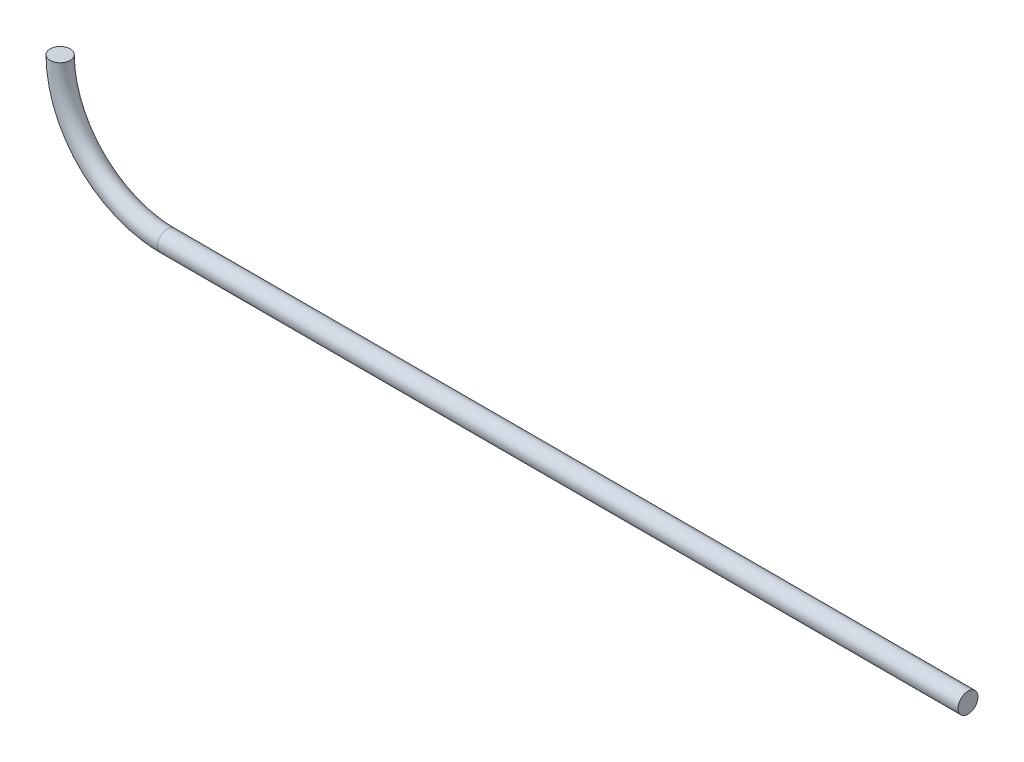
from build123d import *

# Parameters (mm, degrees)
SKETCH6_R = 0.5


with BuildPart() as part:
    # Sweep1: sweep along a path in Sketch1
    with BuildLine(Plane.XY) as sweep1_path:
        Line((40, -5.36), (0, -5.36))
        ThreePointArc((0, -5.36), (-3.790092347, -3.790092347), (-5.36, 0))
    # Sketch6 → Sweep1 (sweep)
    with BuildSketch(Plane(origin=(0, 0, 0), x_dir=(1, 0, 0), z_dir=(0, 1, 0))):
        with Locations((-5.36, 0)):
            Circle(SKETCH6_R)
    sweep(path=sweep1_path.line)


solid = part.part
